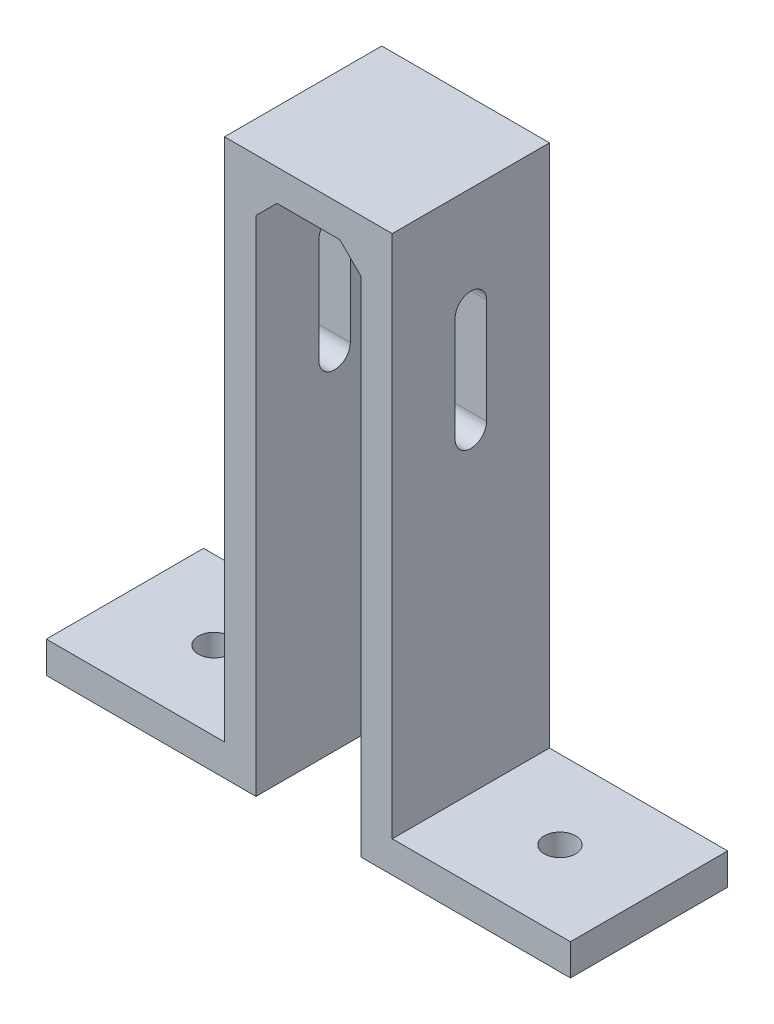
from build123d import *

# Parameters (mm, degrees)
EXTRUDE_1_DEPTH     = 15
SKETCH_2_R          = 1.5
CUT_EXTRUDE_1_DEPTH = 65.210591027
CUT_EXTRUDE_2_DEPTH = 65.210591027
SKETCH_5_R          = 1.5
CUT_EXTRUDE_3_DEPTH = 61.207972894
EXTRUDE_2_DEPTH     = 15


with BuildPart() as part:
    # 草图1 → 凸台-拉伸1 (new body)
    with BuildSketch(Plane.XY):
        Polygon((0, 0), (0, 50), (10, 50), (10, 0), (30, 0), (30, 3), (13, 3), (13, 53), (-3, 53), (-3, 3), (-20, 3), (-20, 0), align=None)
    extrude(amount=EXTRUDE_1_DEPTH)

    # 草图2 → 切除-拉伸1 (cut, through all)
    with BuildSketch(Plane(origin=(13, 0, 0), x_dir=(0, 0, -1), z_dir=(1, 0, 0))):
        with Locations((-7.5, 43)):
            Circle(SKETCH_2_R)
    extrude(amount=-CUT_EXTRUDE_1_DEPTH, mode=Mode.SUBTRACT)

    # 草图4 → 切除-拉伸2 (cut, through all)
    with BuildSketch(Plane(origin=(13, 0, 0), x_dir=(0, 0, -1), z_dir=(1, 0, 0))):
        with BuildLine():
            ThreePointArc((-6, 43), (-7.5, 41.5), (-9, 43))
            Line((-9, 43), (-9, 33))
            ThreePointArc((-9, 33), (-7.5, 34.5), (-6, 33))
            Line((-6, 33), (-6, 43))
        make_face()
        with BuildLine():
            ThreePointArc((-6, 33), (-7.5, 34.5), (-9, 33))
            Line((-9, 33), (-6, 33))
        make_face()
        with BuildLine():
            Line((-6, 33), (-9, 33))
            ThreePointArc((-9, 33), (-7.5, 31.5), (-6, 33))
        make_face()
    extrude(amount=-CUT_EXTRUDE_2_DEPTH, mode=Mode.SUBTRACT)

    # 草图5 → 切除-拉伸3 (cut, through all)
    with BuildSketch(Plane(origin=(0, 3, 0), x_dir=(1, 0, 0), z_dir=(0, 1, 0))):
        with Locations(Location((-11.5, -7.5, 0), (0, 0, 270))):
            Circle(SKETCH_5_R)
        with Locations(Location((21.5, -7.5, 0), (0, 0, 270))):
            Circle(SKETCH_5_R)
    extrude(amount=-CUT_EXTRUDE_3_DEPTH, mode=Mode.SUBTRACT)

    # 草图6 → 凸台-拉伸2 (add)
    with BuildSketch(Plane.XY.offset(15)):
        Polygon((0, 50), (2, 50), (0, 48), align=None)
        Polygon((10, 50), (8, 50), (10, 48), align=None)
    extrude(amount=-EXTRUDE_2_DEPTH)


solid = part.part
